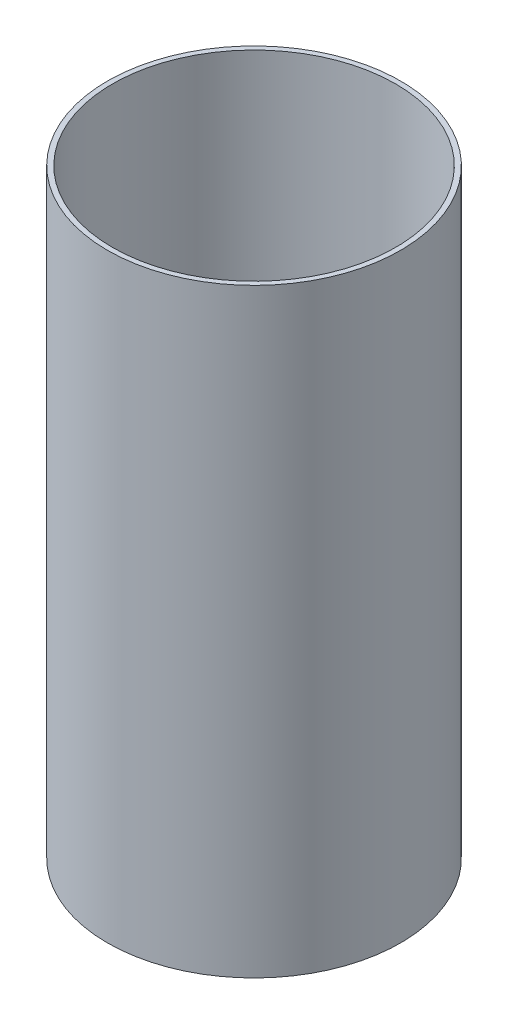
from build123d import *

# Parameters (mm, degrees)
SKETCH1_R               = 88
SKETCH1_R_2             = 85
BOSS_EXTRUDE1_DEPTH     = 360
CUT_EXTRUDE1_REACH      = 412.268
CUT_EXTRUDE1_END_RADIUS = 85
SKETCH2_R               = 2.75


with BuildPart() as part:
    # Sketch1 → Boss-Extrude1 (new body)
    with BuildSketch(Plane(origin=(0, 0, 0), x_dir=(1, 0, 0), z_dir=(0, 1, 0))):
        with Locations(Location((0, 0, 0), (0, 0, 90))):
            Circle(SKETCH1_R)
        with Locations(Location((0, 0, 0), (0, 0, 90))):
            Circle(SKETCH1_R_2, mode=Mode.SUBTRACT)
    extrude(amount=BOSS_EXTRUDE1_DEPTH)

    # Cut-Extrude1: up to this cylinder (the profile starts outside it)
    cut_extrude1_end = Plane(origin=(0, 35, 0), z_dir=(0, -1, 0)) * Cylinder(CUT_EXTRUDE1_END_RADIUS, 995.536, mode=Mode.PRIVATE)
    # Sketch2 → Cut-Extrude1 (cut, up to the surface)
    with BuildSketch(Plane.ZY.offset(88), mode=Mode.PRIVATE) as cut_extrude1_sk1:
        with Locations((0, 35)):
            Circle(SKETCH2_R)
    cut_extrude1_tool1 = extrude(cut_extrude1_sk1.sketch, amount=-CUT_EXTRUDE1_REACH, mode=Mode.PRIVATE) - cut_extrude1_end
    add(cut_extrude1_tool1.solids().sort_by_distance((-88, 35, 0))[0], mode=Mode.SUBTRACT)

    # Sketch4 → Cut-Revolve1 (revolve, cut)
    with BuildSketch(Plane.XZ.offset(-35), mode=Mode.PRIVATE) as cut_revolve1_sk:
        Polygon((-88, 0), (-88, -5), (-83, 0), align=None)
    revolve(cut_revolve1_sk.sketch.rotate(Axis((-88, 35, 0), (1, 0, 0)), 180), axis=Axis((-88, 35, 0), (1, 0, 0)), mode=Mode.SUBTRACT)


solid = part.part
